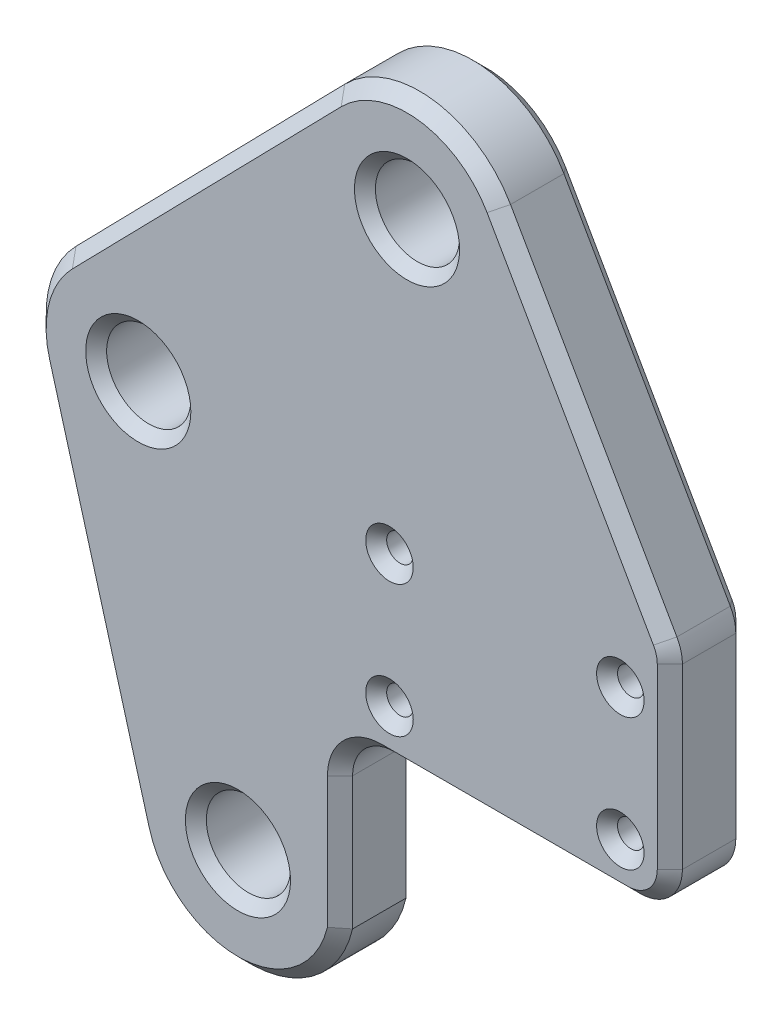
from build123d import *

# Parameters (mm, degrees)
BOSS_EXTRUDE1_DEPTH                   = 4.7625
F_10_CLEARANCE_HOLE1_AT_2_COUNT       = 2
F_10_CLEARANCE_HOLE1_AT_2_PITCH       = 39.612434438
F_10_CLEARANCE_HOLE1_AT_3_COUNT       = 2
F_10_CLEARANCE_HOLE1_AT_3_PITCH       = 22.428811893
FILLET1_R                             = 2.54
F_52_0_0635_DIAMETER_HOLE1_AT_2_COUNT = 2
F_52_0_0635_DIAMETER_HOLE1_AT_2_PITCH = 14
F_52_0_0635_DIAMETER_HOLE1_AT_3_COUNT = 2
F_52_0_0635_DIAMETER_HOLE1_AT_3_PITCH = 16.124515497
F_52_0_0635_DIAMETER_HOLE1_AT_4_COUNT = 2
F_52_0_0635_DIAMETER_HOLE1_AT_4_PITCH = 8
CHAMFER4_SIZE                         = 0.762


with BuildPart() as part:
    # Sketch2 → Boss-Extrude1 (new body)
    with BuildSketch(Plane.XY.offset(49.981386822)):
        with BuildLine():
            Line((-91.534347313, -223.683915635), (-71.534347313, -223.683915635))
            Line((-71.534347313, -223.683915635), (-71.534347313, -209.683915635))
            Line((-71.534347313, -209.683915635), (-81.955963126, -191.43064496))
            ThreePointArc((-81.955963126, -191.43064496), (-86.661422004, -188.280866285), (-92.010183842, -190.139143919))
            Line((-92.010183842, -190.139143919), (-108.307938293, -206.803069118))
            ThreePointArc((-108.307938293, -206.803069118), (-109.919716645, -209.667777106), (-109.883203649, -212.954576174))
            Line((-109.883203649, -212.954576174), (-103.837901654, -234.553324441))
            ThreePointArc((-103.837901654, -234.553324441), (-97.573904916, -239.190042315), (-91.534347313, -234.264542164))
            Line((-91.534347313, -234.264542164), (-91.534347313, -223.683915635))
        make_face()
    extrude(amount=BOSS_EXTRUDE1_DEPTH)

    # Sketch7 → #10 Clearance Hole1 (revolve, cut)
    with BuildSketch(Plane(origin=(-97.722907594, -232.841790729, 54.743886822), x_dir=(0, -1, 0), z_dir=(1, 0, 0))):
        Polygon((0, 0), (0, 4.7625), (3.1877, 4.7625), (2.5527, 4.1275), (2.5527, 0.635), (3.1877, 0), align=None)
    f_10_clearance_hole1 = revolve(axis=Axis((-97.722907594, -232.841790729, 61.093886822), (0, 0, -1)), mode=Mode.SUBTRACT)

    # #10 Clearance Hole1 at 2: #10 Clearance Hole1 ×2
    with Locations(*[Vector(0.25881904510252135, 0.9659258262890682, 0) * (i * F_10_CLEARANCE_HOLE1_AT_2_PITCH) for i in range(1, F_10_CLEARANCE_HOLE1_AT_2_COUNT)]):
        add(f_10_clearance_hole1, mode=Mode.SUBTRACT)

    # #10 Clearance Hole1 at 3: #10 Clearance Hole1 ×2
    with Locations(*[Vector(-0.2695328680059712, 0.9629911905435459, 0) * (i * F_10_CLEARANCE_HOLE1_AT_3_PITCH) for i in range(1, F_10_CLEARANCE_HOLE1_AT_3_COUNT)]):
        add(f_10_clearance_hole1, mode=Mode.SUBTRACT)

    # Fillet1
    fillet1_edges = [part.edges().sort_by_distance(p)[0] for p in [
        (-71.534347313, -209.683915635, 52.362636822),
        (-71.534347313, -223.683915635, 52.362636822),
        (-91.534347313, -223.683915635, 52.362636822),
    ]]
    fillet(fillet1_edges, radius=FILLET1_R)

    # Sketch9 → #52 (0.0635) Diameter Hole1 (revolve, cut)
    with BuildSketch(Plane(origin=(-88.534347313, -212.683915635, 54.743886822), x_dir=(0, -1, 0), z_dir=(1, 0, 0))):
        Polygon((0, 0), (0, 4.7625), (1.44145, 4.7625), (0.80645, 4.1275), (0.80645, 0.635), (1.44145, 0), align=None)
    f_52_0_0635_diameter_hole1 = revolve(axis=Axis((-88.534347313, -212.683915635, 61.093886822), (0, 0, -1)), mode=Mode.SUBTRACT)

    # #52 (0.0635) Diameter Hole1 at 2: #52 (0.0635) Diameter Hole1 ×2
    with Locations(*[(i * F_52_0_0635_DIAMETER_HOLE1_AT_2_PITCH, 0, 0) for i in range(1, F_52_0_0635_DIAMETER_HOLE1_AT_2_COUNT)]):
        add(f_52_0_0635_diameter_hole1, mode=Mode.SUBTRACT)

    # #52 (0.0635) Diameter Hole1 at 3: #52 (0.0635) Diameter Hole1 ×2
    with Locations(*[Vector(0.86824314212446, -0.49613893835683254, 0) * (i * F_52_0_0635_DIAMETER_HOLE1_AT_3_PITCH) for i in range(1, F_52_0_0635_DIAMETER_HOLE1_AT_3_COUNT)]):
        add(f_52_0_0635_diameter_hole1, mode=Mode.SUBTRACT)

    # #52 (0.0635) Diameter Hole1 at 4: #52 (0.0635) Diameter Hole1 ×2
    with Locations(*[(0, -i * F_52_0_0635_DIAMETER_HOLE1_AT_4_PITCH, 0) for i in range(1, F_52_0_0635_DIAMETER_HOLE1_AT_4_COUNT)]):
        add(f_52_0_0635_diameter_hole1, mode=Mode.SUBTRACT)

    # Chamfer4
    chamfer4_edges = [part.edges().sort_by_distance(p)[0] for p in [
        (-97.573904916, -239.190042315, 49.981386822),
        (-106.860552651, -223.753950307, 49.981386822),
        (-109.919716645, -209.667777106, 49.981386822),
        (-100.159061068, -198.471106519, 49.981386822),
        (-86.661422004, -188.280866285, 49.981386822),
        (-86.661422004, -188.280866285, 54.743886822),
        (-100.159061068, -198.471106519, 54.743886822),
        (-109.919716645, -209.667777106, 54.743886822),
        (-106.860552651, -223.753950307, 54.743886822),
        (-97.573904916, -239.190042315, 54.743886822),
        (-76.912256817, -200.264604887, 49.981386822),
        (-76.912256817, -200.264604887, 54.743886822),
        (-91.534347313, -230.2442289, 49.981386822),
        (-71.534347313, -215.750934685, 49.981386822),
        (-81.534347313, -223.683915635, 49.981386822),
        (-72.278296088, -222.939966859, 49.981386822),
        (-71.619319422, -209.706464627, 49.981386822),
        (-71.534347313, -215.750934685, 54.743886822),
        (-91.534347313, -230.2442289, 54.743886822),
        (-81.534347313, -223.683915635, 54.743886822),
        (-72.278296088, -222.939966859, 54.743886822),
        (-71.619319422, -209.706464627, 54.743886822),
        (-90.790398537, -224.427864411, 49.981386822),
        (-90.790398537, -224.427864411, 54.743886822),
    ]]
    chamfer(chamfer4_edges, length=CHAMFER4_SIZE)


solid = part.part
